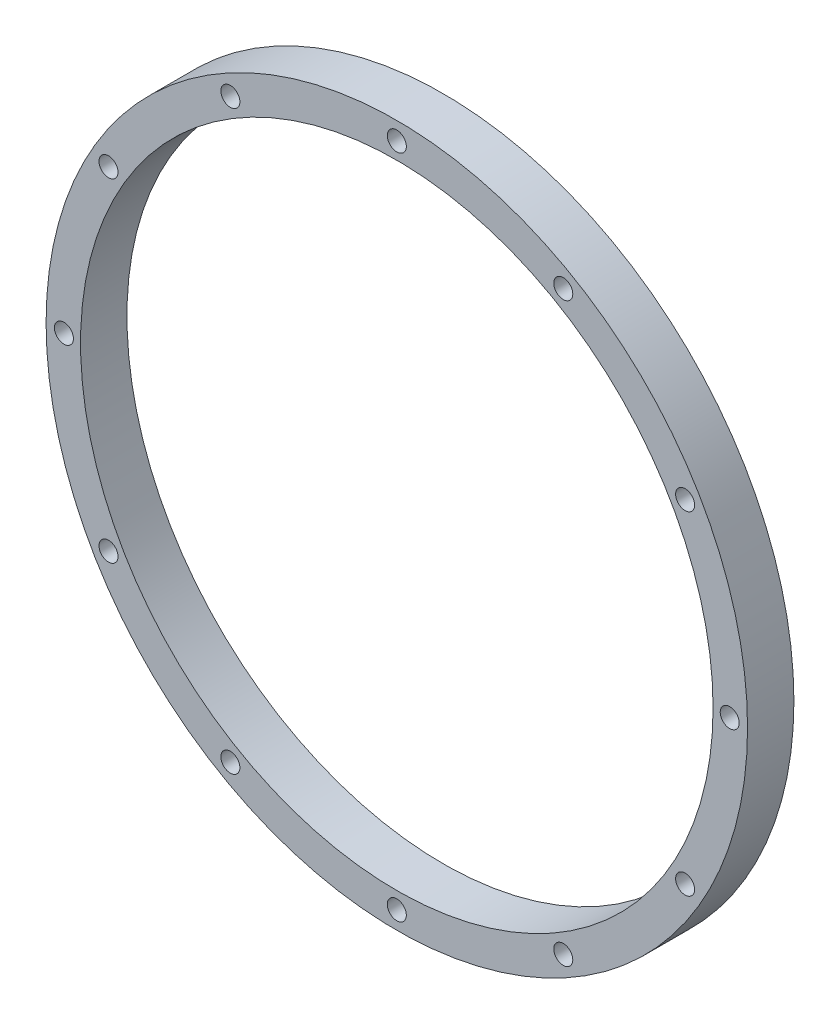
from build123d import *

# Parameters (mm, degrees)
SKETCH_1_R      = 59
SKETCH_1_R_2    = 53.2
SKETCH_1_R_3    = 1.6
EXTRUDE_1_DEPTH = 7.8


with BuildPart() as part:
    # 草图1 → 凸台-拉伸1 (new body)
    with BuildSketch(Plane.XY):
        Circle(SKETCH_1_R)
        Circle(SKETCH_1_R_2, mode=Mode.SUBTRACT)
        with Locations((0, 56)):
            Circle(SKETCH_1_R_3, mode=Mode.SUBTRACT)
        with Locations((28, 48.497422612)):
            Circle(SKETCH_1_R_3, mode=Mode.SUBTRACT)
        with Locations((48.497422612, 28)):
            Circle(SKETCH_1_R_3, mode=Mode.SUBTRACT)
        with Locations((56, 0)):
            Circle(SKETCH_1_R_3, mode=Mode.SUBTRACT)
        with Locations((48.497422612, -28)):
            Circle(SKETCH_1_R_3, mode=Mode.SUBTRACT)
        with Locations((28, -48.497422612)):
            Circle(SKETCH_1_R_3, mode=Mode.SUBTRACT)
        with Locations((0, -56)):
            Circle(SKETCH_1_R_3, mode=Mode.SUBTRACT)
        with Locations((-28, -48.497422612)):
            Circle(SKETCH_1_R_3, mode=Mode.SUBTRACT)
        with Locations((-48.497422612, -28)):
            Circle(SKETCH_1_R_3, mode=Mode.SUBTRACT)
        with Locations((-56, 0)):
            Circle(SKETCH_1_R_3, mode=Mode.SUBTRACT)
        with Locations((-48.497422612, 28)):
            Circle(SKETCH_1_R_3, mode=Mode.SUBTRACT)
        with Locations((-28, 48.497422612)):
            Circle(SKETCH_1_R_3, mode=Mode.SUBTRACT)
    extrude(amount=EXTRUDE_1_DEPTH)


solid = part.part
